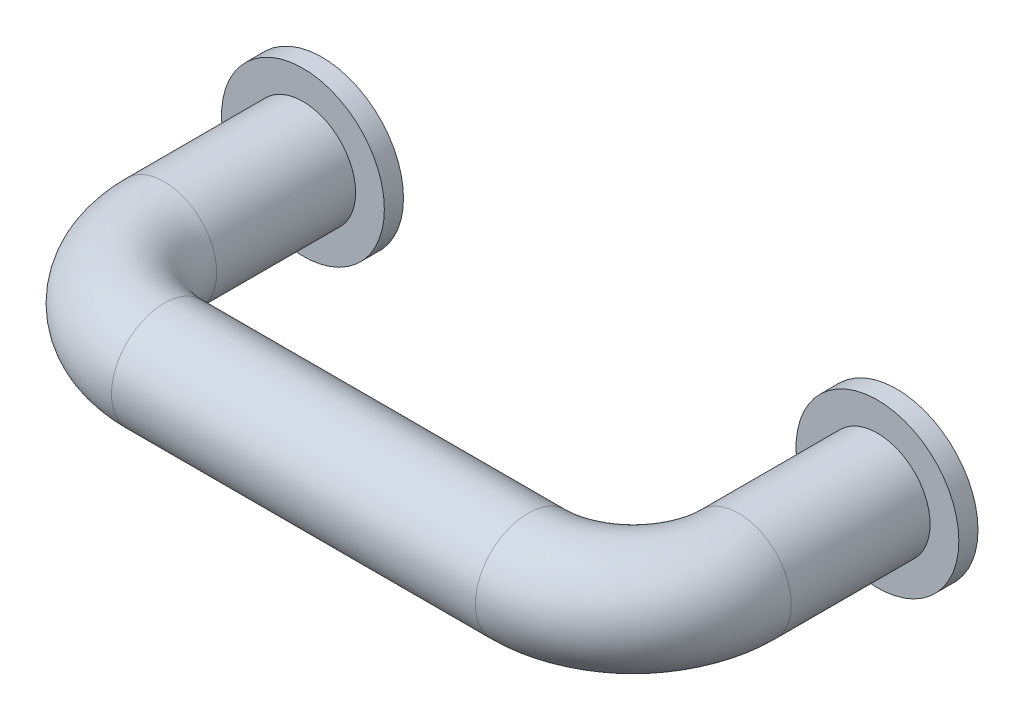
from build123d import *

# Parameters (mm, degrees)
PIPE_1_PROFILE_R   = 11
EXTRUDE_SKETCH_1_R = 17
EXTRUDE_1_DEPTH    = 4
EXTRUDE_SKETCH_2_R = 17
EXTRUDE_2_DEPTH    = 4


with BuildPart() as part:
    # Pipe 1: sweep along a curve in space
    with BuildLine() as pipe_1_path:
        Line((-60, 0, 0), (-60, 0, 33))
        ThreePointArc((-60, 0, 33), (-53.556349186, 0, 48.556349186), (-38, 0, 55))
        Line((-38, 0, 55), (38, 0, 55))
        ThreePointArc((38, 0, 55), (53.556349186, 0, 48.556349186), (60, 0, 33))
        Line((60, 0, 33), (60, 0, 0))
    # Pipe 1 profile (on start of the path) → Pipe 1 (sweep)
    with BuildSketch(Plane(origin=(-60, 0, 0), x_dir=(1, 0, 0), z_dir=(0, 0, 1))):
        Circle(PIPE_1_PROFILE_R)
    sweep(path=pipe_1_path.line)


with BuildPart() as body_2:
    # Extrude sketch 1 → Extrude 1 (new body)
    with BuildSketch(Plane.XY):
        with Locations((-60, 0)):
            Circle(EXTRUDE_SKETCH_1_R)
    extrude(amount=EXTRUDE_1_DEPTH)


with BuildPart() as body_3:
    # Extrude sketch 2 → Extrude 2 (new body)
    with BuildSketch(Plane.XY):
        with Locations((60, 0)):
            Circle(EXTRUDE_SKETCH_2_R)
    extrude(amount=EXTRUDE_2_DEPTH)


with BuildPart() as body_2_1:
    add(body_2.part)

    # Combine (weld / assembly of features): union body 3, part
    add(body_3.part)
    add(part.part)


solid = body_2_1.part
